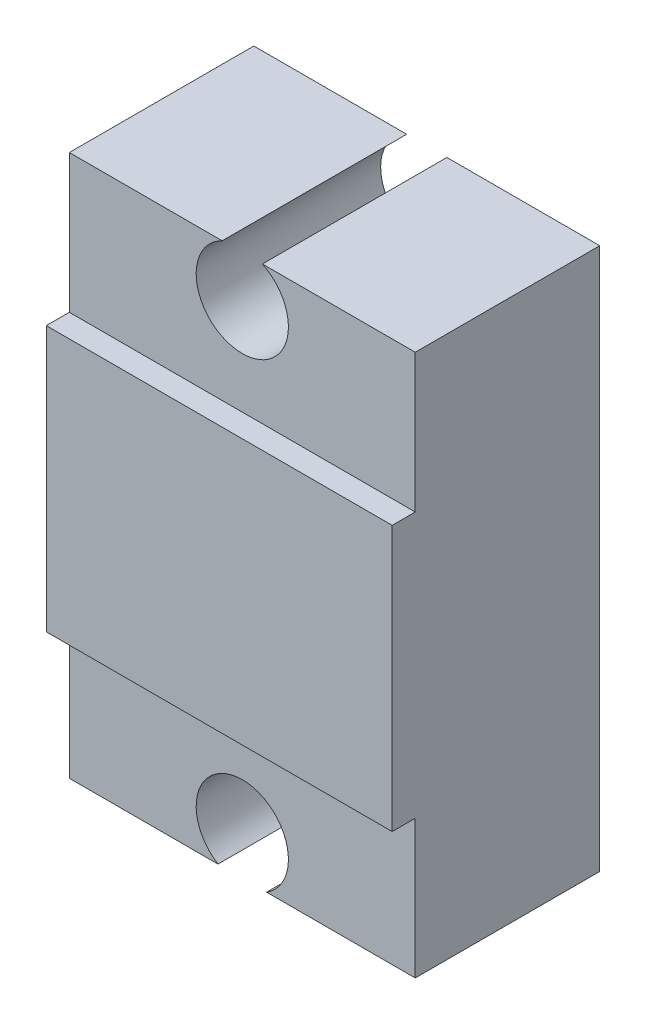
from build123d import *

# Parameters (mm, degrees)
SKETCH1_W           = 19.05
SKETCH1_H           = 29.845
BOSS_EXTRUDE1_DEPTH = 11.43
SKETCH2_R           = 2.54
CUT_EXTRUDE1_DEPTH  = 11.43
SKETCH3_W           = 19.05
SKETCH3_H           = 7.62
CUT_EXTRUDE2_DEPTH  = 1.27


with BuildPart() as part:
    # Sketch1 → Boss-Extrude1 (new body)
    with BuildSketch(Plane.XY):
        with Locations((1.663095238, -4.906130952)):
            Rectangle(SKETCH1_W, SKETCH1_H)
    extrude(amount=BOSS_EXTRUDE1_DEPTH)

    # Sketch2 → Cut-Extrude1 (cut)
    with BuildSketch(Plane.XY.offset(11.43)):
        with Locations((1.663095238, 7.730369048)):
            Circle(SKETCH2_R)
        with Locations((1.663095238, -17.669630952)):
            Circle(SKETCH2_R)
    extrude(amount=-CUT_EXTRUDE1_DEPTH, mode=Mode.SUBTRACT)

    # Sketch3 → Cut-Extrude2 (cut)
    with BuildSketch(Plane.XY.offset(11.43)):
        with Locations((1.663095238, 6.206369048)):
            Rectangle(SKETCH3_W, SKETCH3_H)
        with Locations((1.663095238, -16.018630952)):
            Rectangle(SKETCH3_W, SKETCH3_H)
    extrude(amount=-CUT_EXTRUDE2_DEPTH, mode=Mode.SUBTRACT)


solid = part.part
